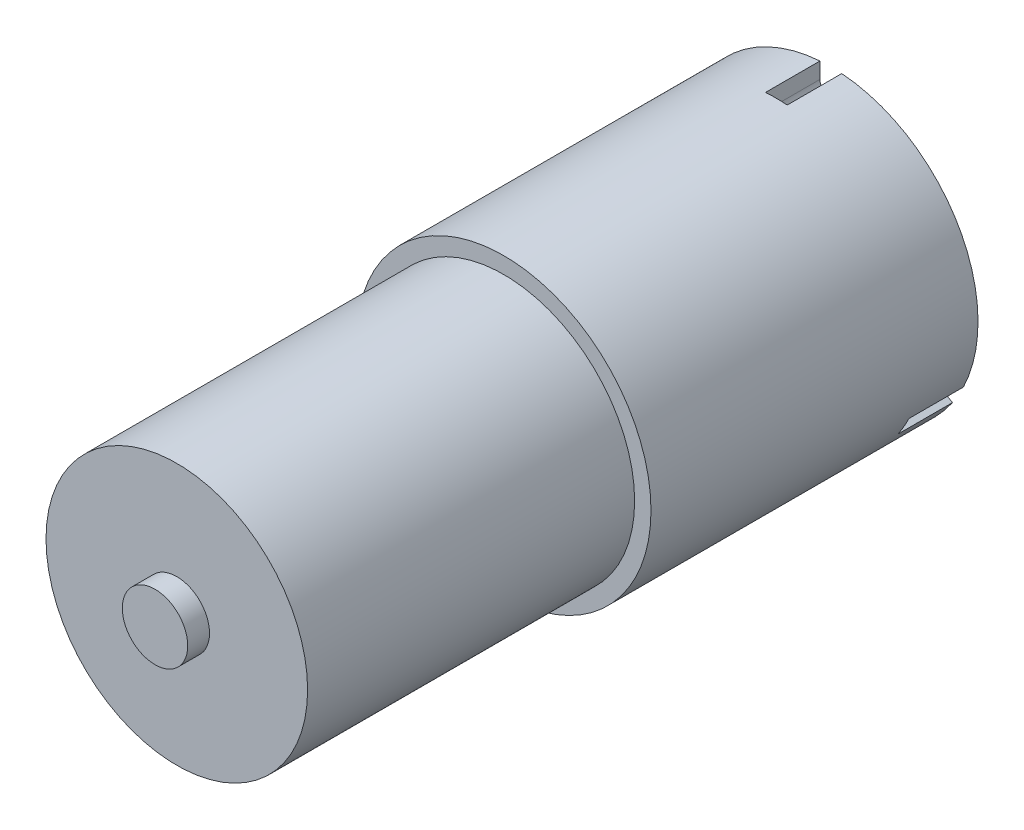
from build123d import *

# Parameters (mm, degrees)
SKETCH_1_R          = 13.5
EXTRUDE_1_DEPTH     = 30
SKETCH_2_R          = 12
EXTRUDE_2_DEPTH     = 30
SKETCH_3_R          = 3
EXTRUDE_3_DEPTH     = 2
CUT_EXTRUDE_1_DEPTH = 5
SKETCH_5_R          = 1.25
EXTRUDE_4_DEPTH     = 5
FILLET_1_R          = 0.5


with BuildPart() as part:
    # 草图1 → 凸台-拉伸1 (new body)
    with BuildSketch(Plane.XY):
        Circle(SKETCH_1_R)
    extrude(amount=EXTRUDE_1_DEPTH)

    # 草图2 → 凸台-拉伸2 (add)
    with BuildSketch(Plane.XY.offset(30)):
        Circle(SKETCH_2_R)
    extrude(amount=EXTRUDE_2_DEPTH)

    # 草图3 → 凸台-拉伸3 (add)
    with BuildSketch(Plane.XY.offset(60)):
        Circle(SKETCH_3_R)
    extrude(amount=EXTRUDE_3_DEPTH)

    # 草图4 → 切除-拉伸1 (cut)
    with BuildSketch(Plane(origin=(0, 0, 0), x_dir=(-1, 0, 0), z_dir=(0, 0, -1))):
        with BuildLine():
            Line((-1, 12), (-1, 13.978745528))
            Line((-1, 13.978745528), (1, 13.978745528))
            Line((1, 13.978745528), (1, 12))
            ThreePointArc((1, 12), (0, 11), (-1, 12))
        make_face()
        with BuildLine():
            Line((10.892304845, -5.133974596), (12.60594874, -6.12334736))
            Line((12.60594874, -6.12334736), (11.60594874, -7.855398168))
            Line((11.60594874, -7.855398168), (9.892304845, -6.866025404))
            ThreePointArc((9.892304845, -6.866025404), (9.526279442, -5.5), (10.892304845, -5.133974596))
        make_face()
        with BuildLine():
            Line((-9.892304845, -6.866025404), (-11.60594874, -7.855398168))
            Line((-11.60594874, -7.855398168), (-12.60594874, -6.12334736))
            Line((-12.60594874, -6.12334736), (-10.892304845, -5.133974596))
            ThreePointArc((-10.892304845, -5.133974596), (-9.526279442, -5.5), (-9.892304845, -6.866025404))
        make_face()
    extrude(amount=-CUT_EXTRUDE_1_DEPTH, mode=Mode.SUBTRACT)

    # 草图5 → 凸台-拉伸4 (add)
    with BuildSketch(Plane(origin=(0, 0, 0), x_dir=(-1, 0, 0), z_dir=(0, 0, -1))):
        with Locations(Location((0, 0, 0), (0, 0, 180))):
            Circle(SKETCH_5_R)
        with Locations(Location((6, 0, 0), (0, 0, 180))):
            Circle(SKETCH_5_R)
    extrude(amount=EXTRUDE_4_DEPTH)

    # 圆角1
    fillet_1_edges = [part.edges().sort_by_distance(p)[0] for p in [
        (-1.25, 0, -5),
        (-7.25, 0, -5),
    ]]
    fillet(fillet_1_edges, radius=FILLET_1_R)


solid = part.part
